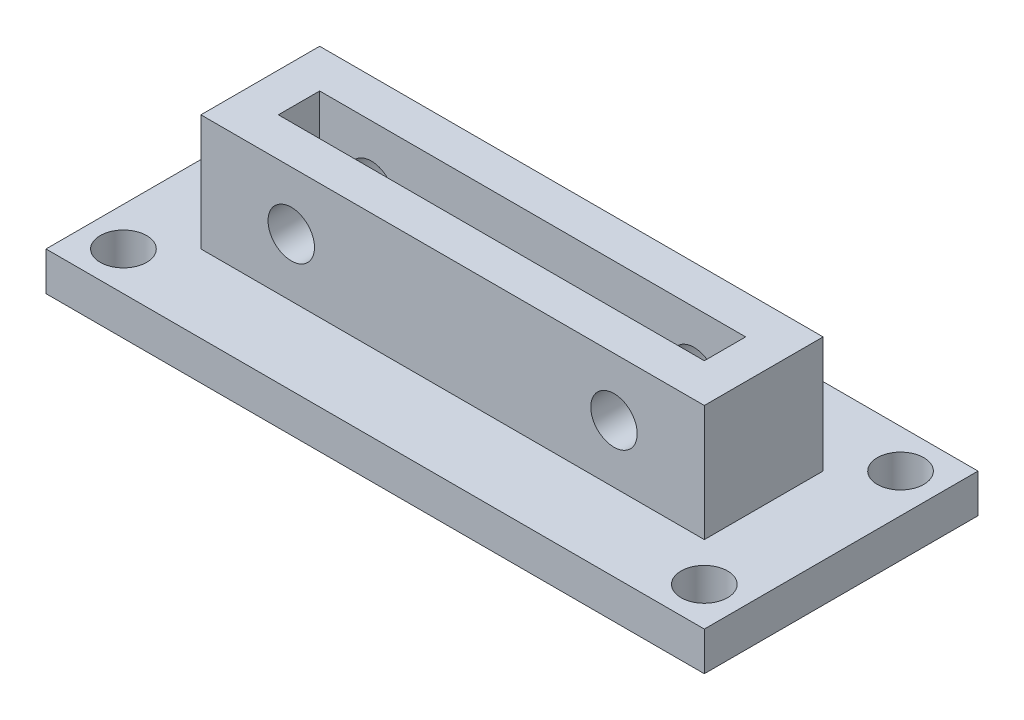
from build123d import *

# Parameters (mm, degrees)
SKETCH1_W            = 51
SKETCH1_H            = 21.2
BOSS_EXTRUDE1_DEPTH  = 3
SKETCH2_W            = 39
SKETCH2_H            = 9.2
SKETCH2_W_2          = 33
SKETCH2_H_2          = 3.2
BOSS_EXTRUDE2_DEPTH  = 9
M3_CLEARANCE_HOLE1_D = 3.6
M3_CLEARANCE_HOLE2_D = 3.6


with BuildPart() as part:
    # Sketch1 → Boss-Extrude1 (new body)
    with BuildSketch(Plane(origin=(0, 0, 0), x_dir=(1, 0, 0), z_dir=(0, 1, 0))):
        with Locations((25.5, 10.6)):
            Rectangle(SKETCH1_W, SKETCH1_H)
    extrude(amount=BOSS_EXTRUDE1_DEPTH)

    # Sketch2 → Boss-Extrude2 (add)
    with BuildSketch(Plane(origin=(0, 3, 0), x_dir=(1, 0, 0), z_dir=(0, 1, 0))):
        with Locations((25.5, 10.6)):
            Rectangle(SKETCH2_W, SKETCH2_H)
        with Locations((25.5, 10.6)):
            Rectangle(SKETCH2_W_2, SKETCH2_H_2, mode=Mode.SUBTRACT)
    extrude(amount=BOSS_EXTRUDE2_DEPTH)

    # M3 Clearance Hole1 (through all)
    with Locations(Plane(origin=(0, 3, 0), x_dir=(1, 0, 0), z_dir=(0, 1, 0))):
        with Locations((3, 18.2), (48, 18.2), (48, 3), (3, 3)):
            Hole(M3_CLEARANCE_HOLE1_D / 2)

    # M3 Clearance Hole2 (through all)
    with Locations(Plane.XY.offset(-6)):
        with Locations((13, 7.5), (38, 7.5)):
            Hole(M3_CLEARANCE_HOLE2_D / 2)


solid = part.part
